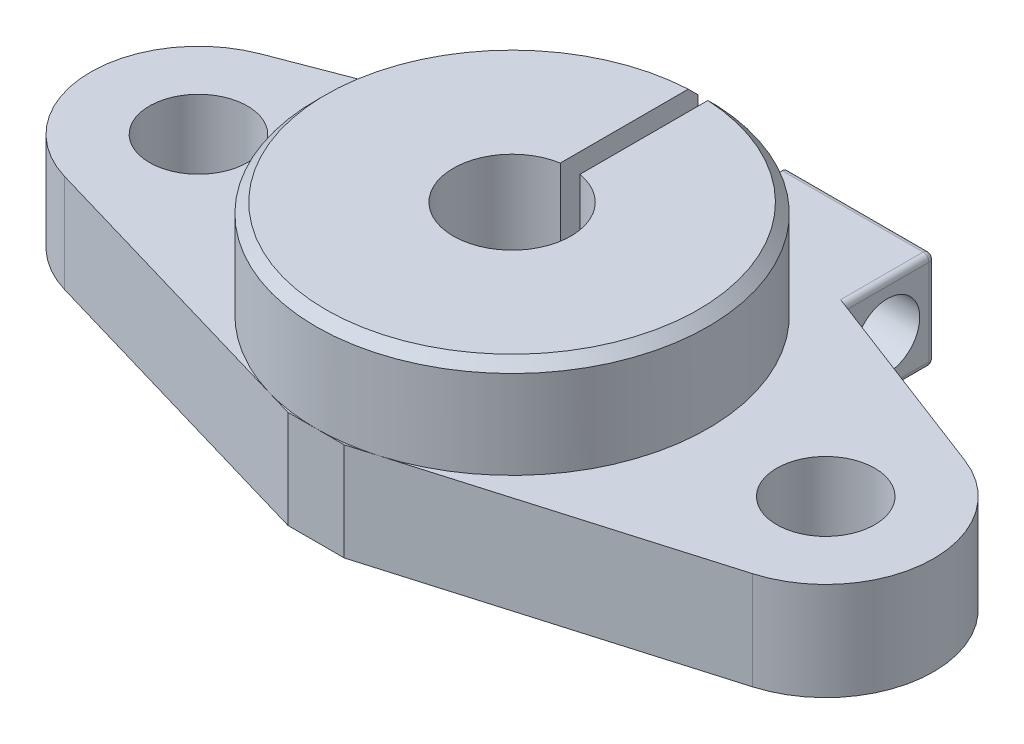
from build123d import *

# Parameters (mm, degrees)
SKETCH_1_R          = 2.5
SKETCH_1_R_2        = 3
EXTRUDE_1_DEPTH     = 5
SKETCH_2_R          = 10
SKETCH_2_R_2        = 3
EXTRUDE_2_DEPTH     = 5
FILLET_1_R          = 0.3
CHAMFER_1_SIZE      = 0.5
CUT_EXTRUDE_1_REACH = 29.325
SKETCH_3_W          = 1
SKETCH_3_H          = 13.579366256
HOLE_WIZARD_M4_1_D  = 3.3


with BuildPart() as part:
    # 草图1 → 凸台-拉伸1 (new body)
    with BuildSketch(Plane(origin=(0, 0, 0), x_dir=(1, 0, 0), z_dir=(0, 1, 0))):
        with BuildLine():
            Line((-17.966197006, 5.136542547), (-7.985903938, 8.956859846))
            Line((-7.985903938, 8.956859846), (-7.985903938, 13.579366256))
            Line((-7.985903938, 13.579366256), (7.985903938, 13.579366256))
            Line((7.985903938, 13.579366256), (7.985903938, 8.956859846))
            Line((7.985903938, 8.956859846), (17.966197006, 5.136542547))
            ThreePointArc((17.966197006, 5.136542547), (21.495547327, -0.221268111), (17.546875, -5.277989933))
            Line((17.546875, -5.277989933), (1.435216594, -10))
            Line((1.435216594, -10), (-1.435216594, -10))
            Line((-1.435216594, -10), (-17.546875, -5.277989933))
            ThreePointArc((-17.546875, -5.277989933), (-21.495547327, -0.221268111), (-17.966197006, 5.136542547))
        make_face()
        with Locations(Location((-16, 0, 0), (0, 0, 270))):
            Circle(SKETCH_1_R, mode=Mode.SUBTRACT)
        with Locations(Location((0, 0, 0), (0, 0, 270))):
            Circle(SKETCH_1_R_2, mode=Mode.SUBTRACT)
        with Locations(Location((16, 0, 0), (0, 0, 90))):
            Circle(SKETCH_1_R, mode=Mode.SUBTRACT)
    extrude(amount=EXTRUDE_1_DEPTH)

    # 草图2 → 凸台-拉伸2 (add)
    with BuildSketch(Plane(origin=(0, 5, 0), x_dir=(1, 0, 0), z_dir=(0, 1, 0))):
        with Locations(Location((0, 0, 0), (0, 0, 270))):
            Circle(SKETCH_2_R)
        with Locations(Location((0, 0, 0), (0, 0, 270))):
            Circle(SKETCH_2_R_2, mode=Mode.SUBTRACT)
    extrude(amount=EXTRUDE_2_DEPTH)

    # 圆角1
    fillet_1_edges = [part.edges().sort_by_distance(p)[0] for p in [
        (0, 0, -13.579366256),
        (7.985903938, 0, -11.268113051),
        (-7.985903938, 2.5, -13.579366256),
        (7.985903938, 2.5, -13.579366256),
        (7.985903938, 5, -11.268113051),
        (0, 5, -13.579366256),
        (-7.985903938, 5, -11.268113051),
        (-7.985903938, 0, -11.268113051),
    ]]
    fillet(fillet_1_edges, radius=FILLET_1_R)

    # 倒角1
    chamfer_1_edges = [part.edges().sort_by_distance(p)[0] for p in [
        (0, 10, -10),
    ]]
    chamfer(chamfer_1_edges, length=CHAMFER_1_SIZE)

    # 草图3 → 切除-拉伸1 (cut, up to next)
    with BuildSketch(Plane(origin=(0, 10, 0), x_dir=(1, 0, 0), z_dir=(0, 1, 0)), mode=Mode.PRIVATE) as cut_extrude_1_sk1:
        with Locations((0, 6.789683128)):
            Rectangle(SKETCH_3_W, SKETCH_3_H)
    cut_extrude_1_tool1 = extrude(cut_extrude_1_sk1.sketch, amount=-CUT_EXTRUDE_1_REACH, mode=Mode.PRIVATE) & part.part
    add(cut_extrude_1_tool1.solids().sort_by_distance((0, 10, -6.789683))[0], mode=Mode.SUBTRACT)

    # M4 螺纹孔1 (through all)
    with Locations(Plane(origin=(-7.985903938, 2.5, -11.156859846), x_dir=(0, 0, -1), z_dir=(-1, 0, 0))):
        with Locations((0, 0)):
            Hole(HOLE_WIZARD_M4_1_D / 2)


solid = part.part
